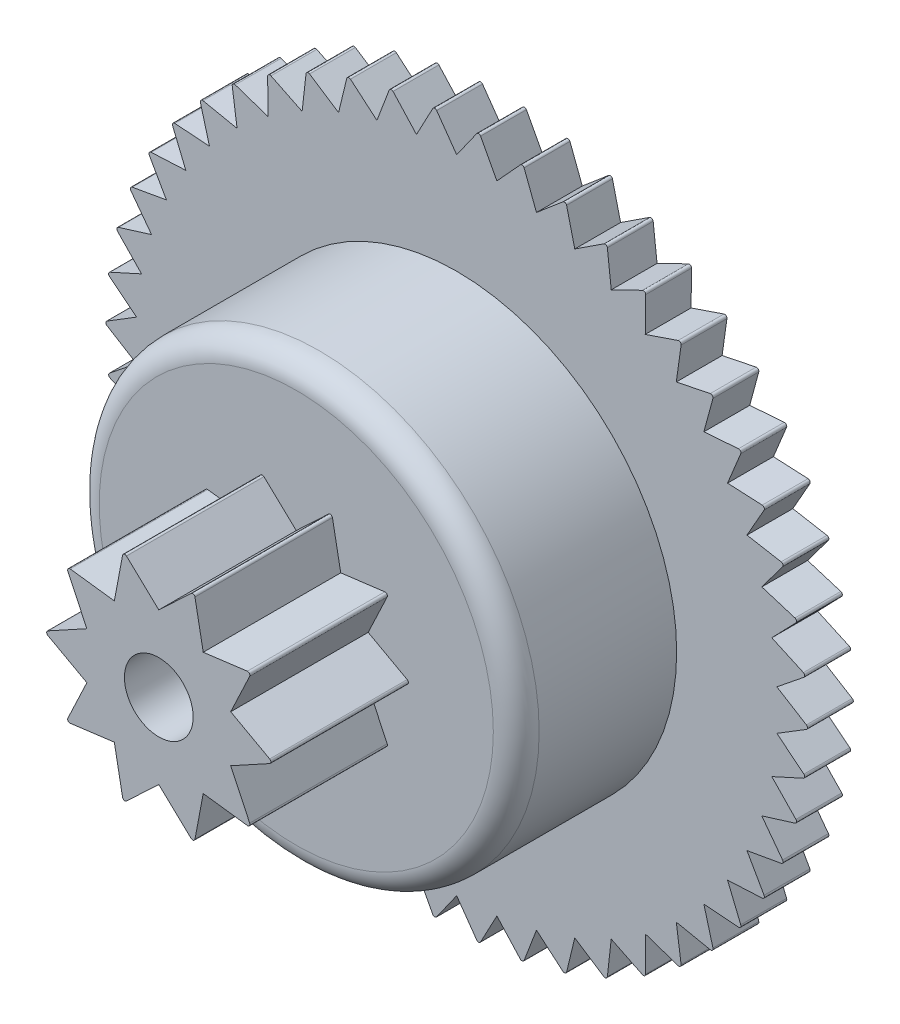
from build123d import *

# Parameters (mm, degrees)
SKETCH_1_R           = 7.7
EXTRUDE_1_DEPTH      = 1
SKETCH_2_R           = 4.8
EXTRUDE_2_DEPTH      = 3.5
SKETCH_3_R           = 2.5
EXTRUDE_3_DEPTH      = 3
SKETCH_4_OUTSIDE_W   = 22.006
SKETCH_4_OUTSIDE_H   = 22.006
CUT_EXTRUDE_7_DEPTH  = 3
SKETCH_6_OUTSIDE_W   = 21.888
SKETCH_6_OUTSIDE_H   = 21.858
CUT_EXTRUDE_8_DEPTH  = 3
SKETCH_7_R           = 0.75
CUT_EXTRUDE_9_DEPTH  = 14.160832224
SKETCH_8_R           = 3.75
CUT_EXTRUDE_10_DEPTH = 3.5
FILLET_1_R           = 0.5
FILLET_2_R           = 0.5


with BuildPart() as part:
    # 草圖1 → 伸長1 (new body)
    with BuildSketch(Plane.XY):
        Circle(SKETCH_1_R)
    extrude(amount=EXTRUDE_1_DEPTH)

    # 草圖2 → 伸長2 (add)
    with BuildSketch(Plane.XY.offset(1)):
        Circle(SKETCH_2_R)
    extrude(amount=EXTRUDE_2_DEPTH)

    # 草圖3 → 伸長3 (add)
    with BuildSketch(Plane.XY.offset(4.5)):
        Circle(SKETCH_3_R)
    extrude(amount=EXTRUDE_3_DEPTH)

    # 草圖4 outside → 伸長7 (cut)
    with BuildSketch(Plane.XY.offset(1)):
        Rectangle(SKETCH_4_OUTSIDE_W, SKETCH_4_OUTSIDE_H)
        with BuildLine():
            Line((0, 7), (0.436653531, 7.618471384))
            ThreePointArc((0.436653531, 7.618471384), (0.480638789, 7.639534792), (0.521637266, 7.61312466))
            Line((0.521637266, 7.61312466), (0.877332635, 6.944802909))
            Line((0.877332635, 6.944802909), (1.38805804, 7.503670263))
            ThreePointArc((1.38805804, 7.503670263), (1.434336407, 7.519054765), (1.471701532, 7.487714413))
            Line((1.471701532, 7.487714413), (1.74082921, 6.780082128))
            Line((1.74082921, 6.780082128), (2.317572046, 7.270531779))
            ThreePointArc((2.317572046, 7.270531779), (2.365413683, 7.279994752), (2.398556185, 7.244218437))
            Line((2.398556185, 7.244218437), (2.576871869, 6.508435401))
            Line((2.576871869, 6.508435401), (3.210536556, 6.922732666))
            ThreePointArc((3.210536556, 6.922732666), (3.259186973, 6.926124873), (3.287584175, 6.886476808))
            Line((3.287584175, 6.886476808), (3.372275719, 6.13414676))
            Line((3.372275719, 6.13414676), (4.052868986, 6.465757923))
            ThreePointArc((4.052868986, 6.465757923), (4.101560936, 6.463025868), (4.124764998, 6.420131326))
            Line((4.124764998, 6.420131326), (4.114496766, 5.663118961))
            Line((4.114496766, 5.663118961), (4.831285251, 5.906814315))
            ThreePointArc((4.831285251, 5.906814315), (4.879250834, 5.898001084), (4.896895813, 5.852536538))
            Line((4.896895813, 5.852536538), (4.791829742, 5.102780392))
            Line((4.791829742, 5.102780392), (5.533509262, 5.254716717))
            ThreePointArc((5.533509262, 5.254716717), (5.579992031, 5.239961299), (5.591799655, 5.192643753))
            Line((5.591799655, 5.192643753), (5.393592699, 4.461967928))
            Line((5.393592699, 4.461967928), (6.148466527, 4.519749097))
            ThreePointArc((6.148466527, 4.519749097), (6.192733421, 4.499284195), (6.198517477, 4.450859874))
            Line((6.198517477, 4.450859874), (5.910295479, 3.750787565))
            Line((5.910295479, 3.750787565), (6.666458801, 3.713502335))
            ThreePointArc((6.666458801, 3.713502335), (6.707811705, 3.687650691), (6.707480976, 3.638883276))
            Line((6.707480976, 3.638883276), (6.333789367, 2.980455041))
            Line((6.333789367, 2.980455041), (7.079317038, 2.848691422))
            ThreePointArc((7.079317038, 2.848691422), (7.117103791, 2.817860733), (7.110663492, 2.769519314))
            Line((7.110663492, 2.769519314), (6.657395614, 2.163118961))
            Line((6.657395614, 2.163118961), (7.380530216, 1.938954943))
            ThreePointArc((7.380530216, 1.938954943), (7.4141549, 1.903631427), (7.401706598, 1.856478379))
            Line((7.401706598, 1.856478379), (6.876010755, 1.311669202))
            Line((6.876010755, 1.311669202), (7.565348023, 0.998639987))
            ThreePointArc((7.565348023, 0.998639987), (7.594280356, 0.959380717), (7.576020369, 0.914159671))
            Line((7.576020369, 0.914159671), (6.986187099, 0.439533637))
            Line((6.986187099, 0.439533637), (7.630855773, 0.042575882))
            ThreePointArc((7.630855773, 0.042575882), (7.654639475, 0), (7.630855773, -0.042575882))
            Line((7.630855773, -0.042575882), (6.986187099, -0.439533637))
            Line((6.986187099, -0.439533637), (7.576020369, -0.914159671))
            ThreePointArc((7.576020369, -0.914159671), (7.594280356, -0.959380717), (7.565348023, -0.998639987))
            Line((7.565348023, -0.998639987), (6.876010755, -1.311669202))
            Line((6.876010755, -1.311669202), (7.401706598, -1.856478379))
            ThreePointArc((7.401706598, -1.856478379), (7.4141549, -1.903631427), (7.380530216, -1.938954943))
            Line((7.380530216, -1.938954943), (6.657395614, -2.163118961))
            Line((6.657395614, -2.163118961), (7.110663492, -2.769519314))
            ThreePointArc((7.110663492, -2.769519314), (7.117103791, -2.817860733), (7.079317038, -2.848691422))
            Line((7.079317038, -2.848691422), (6.333789367, -2.980455041))
            Line((6.333789367, -2.980455041), (6.707480976, -3.638883276))
            ThreePointArc((6.707480976, -3.638883276), (6.707811705, -3.687650691), (6.666458801, -3.713502335))
            Line((6.666458801, -3.713502335), (5.910295479, -3.750787565))
            Line((5.910295479, -3.750787565), (6.198517477, -4.450859874))
            ThreePointArc((6.198517477, -4.450859874), (6.192733421, -4.499284195), (6.148466527, -4.519749097))
            Line((6.148466527, -4.519749097), (5.393592699, -4.461967928))
            Line((5.393592699, -4.461967928), (5.591799655, -5.192643753))
            ThreePointArc((5.591799655, -5.192643753), (5.579992031, -5.239961299), (5.533509262, -5.254716717))
            Line((5.533509262, -5.254716717), (4.791829742, -5.102780392))
            Line((4.791829742, -5.102780392), (4.896895813, -5.852536538))
            ThreePointArc((4.896895813, -5.852536538), (4.879250834, -5.898001084), (4.831285251, -5.906814315))
            Line((4.831285251, -5.906814315), (4.114496766, -5.663118961))
            Line((4.114496766, -5.663118961), (4.124764998, -6.420131326))
            ThreePointArc((4.124764998, -6.420131326), (4.101560936, -6.463025868), (4.052868986, -6.465757923))
            Line((4.052868986, -6.465757923), (3.372275719, -6.13414676))
            Line((3.372275719, -6.13414676), (3.287584175, -6.886476808))
            ThreePointArc((3.287584175, -6.886476808), (3.259186973, -6.926124873), (3.210536556, -6.922732666))
            Line((3.210536556, -6.922732666), (2.576871869, -6.508435401))
            Line((2.576871869, -6.508435401), (2.398556185, -7.244218437))
            ThreePointArc((2.398556185, -7.244218437), (2.365413683, -7.279994752), (2.317572046, -7.270531779))
            Line((2.317572046, -7.270531779), (1.74082921, -6.780082128))
            Line((1.74082921, -6.780082128), (1.471701532, -7.487714413))
            ThreePointArc((1.471701532, -7.487714413), (1.434336407, -7.519054765), (1.38805804, -7.503670263))
            Line((1.38805804, -7.503670263), (0.877332635, -6.944802909))
            Line((0.877332635, -6.944802909), (0.521637266, -7.61312466))
            ThreePointArc((0.521637266, -7.61312466), (0.480638789, -7.639534792), (0.436653531, -7.618471384))
            Line((0.436653531, -7.618471384), (0, -7))
            Line((0, -7), (-0.436653531, -7.618471384))
            ThreePointArc((-0.436653531, -7.618471384), (-0.480638789, -7.639534792), (-0.521637266, -7.61312466))
            Line((-0.521637266, -7.61312466), (-0.877332635, -6.944802909))
            Line((-0.877332635, -6.944802909), (-1.38805804, -7.503670263))
            ThreePointArc((-1.38805804, -7.503670263), (-1.434336407, -7.519054765), (-1.471701532, -7.487714413))
            Line((-1.471701532, -7.487714413), (-1.74082921, -6.780082128))
            Line((-1.74082921, -6.780082128), (-2.317572046, -7.270531779))
            ThreePointArc((-2.317572046, -7.270531779), (-2.365413683, -7.279994752), (-2.398556185, -7.244218437))
            Line((-2.398556185, -7.244218437), (-2.576871869, -6.508435401))
            Line((-2.576871869, -6.508435401), (-3.210536556, -6.922732666))
            ThreePointArc((-3.210536556, -6.922732666), (-3.259186973, -6.926124873), (-3.287584175, -6.886476808))
            Line((-3.287584175, -6.886476808), (-3.372275719, -6.13414676))
            Line((-3.372275719, -6.13414676), (-4.052868986, -6.465757923))
            ThreePointArc((-4.052868986, -6.465757923), (-4.101560936, -6.463025868), (-4.124764998, -6.420131326))
            Line((-4.124764998, -6.420131326), (-4.114496766, -5.663118961))
            Line((-4.114496766, -5.663118961), (-4.831285251, -5.906814315))
            ThreePointArc((-4.831285251, -5.906814315), (-4.879250834, -5.898001084), (-4.896895813, -5.852536538))
            Line((-4.896895813, -5.852536538), (-4.791829742, -5.102780392))
            Line((-4.791829742, -5.102780392), (-5.533509262, -5.254716717))
            ThreePointArc((-5.533509262, -5.254716717), (-5.579992031, -5.239961299), (-5.591799655, -5.192643753))
            Line((-5.591799655, -5.192643753), (-5.393592699, -4.461967928))
            Line((-5.393592699, -4.461967928), (-6.148466527, -4.519749097))
            ThreePointArc((-6.148466527, -4.519749097), (-6.192733421, -4.499284195), (-6.198517477, -4.450859874))
            Line((-6.198517477, -4.450859874), (-5.910295479, -3.750787565))
            Line((-5.910295479, -3.750787565), (-6.666458801, -3.713502335))
            ThreePointArc((-6.666458801, -3.713502335), (-6.707811705, -3.687650691), (-6.707480976, -3.638883276))
            Line((-6.707480976, -3.638883276), (-6.333789367, -2.980455041))
            Line((-6.333789367, -2.980455041), (-7.079317038, -2.848691422))
            ThreePointArc((-7.079317038, -2.848691422), (-7.117103791, -2.817860733), (-7.110663492, -2.769519314))
            Line((-7.110663492, -2.769519314), (-6.657395614, -2.163118961))
            Line((-6.657395614, -2.163118961), (-7.380530216, -1.938954943))
            ThreePointArc((-7.380530216, -1.938954943), (-7.4141549, -1.903631427), (-7.401706598, -1.856478379))
            Line((-7.401706598, -1.856478379), (-6.876010755, -1.311669202))
            Line((-6.876010755, -1.311669202), (-7.565348023, -0.998639987))
            ThreePointArc((-7.565348023, -0.998639987), (-7.594280356, -0.959380717), (-7.576020369, -0.914159671))
            Line((-7.576020369, -0.914159671), (-6.986187099, -0.439533637))
            Line((-6.986187099, -0.439533637), (-7.630855773, -0.042575882))
            ThreePointArc((-7.630855773, -0.042575882), (-7.654639475, 0), (-7.630855773, 0.042575882))
            Line((-7.630855773, 0.042575882), (-6.986187099, 0.439533637))
            Line((-6.986187099, 0.439533637), (-7.576020369, 0.914159671))
            ThreePointArc((-7.576020369, 0.914159671), (-7.594280356, 0.959380717), (-7.565348023, 0.998639987))
            Line((-7.565348023, 0.998639987), (-6.876010755, 1.311669202))
            Line((-6.876010755, 1.311669202), (-7.401706598, 1.856478379))
            ThreePointArc((-7.401706598, 1.856478379), (-7.4141549, 1.903631427), (-7.380530216, 1.938954943))
            Line((-7.380530216, 1.938954943), (-6.657395614, 2.163118961))
            Line((-6.657395614, 2.163118961), (-7.110663492, 2.769519314))
            ThreePointArc((-7.110663492, 2.769519314), (-7.117103791, 2.817860733), (-7.079317038, 2.848691422))
            Line((-7.079317038, 2.848691422), (-6.333789367, 2.980455041))
            Line((-6.333789367, 2.980455041), (-6.707480976, 3.638883276))
            ThreePointArc((-6.707480976, 3.638883276), (-6.707811705, 3.687650691), (-6.666458801, 3.713502335))
            Line((-6.666458801, 3.713502335), (-5.910295479, 3.750787565))
            Line((-5.910295479, 3.750787565), (-6.198517477, 4.450859874))
            ThreePointArc((-6.198517477, 4.450859874), (-6.192733421, 4.499284195), (-6.148466527, 4.519749097))
            Line((-6.148466527, 4.519749097), (-5.393592699, 4.461967928))
            Line((-5.393592699, 4.461967928), (-5.591799655, 5.192643753))
            ThreePointArc((-5.591799655, 5.192643753), (-5.579992031, 5.239961299), (-5.533509262, 5.254716717))
            Line((-5.533509262, 5.254716717), (-4.791829742, 5.102780392))
            Line((-4.791829742, 5.102780392), (-4.896895813, 5.852536538))
            ThreePointArc((-4.896895813, 5.852536538), (-4.879250834, 5.898001084), (-4.831285251, 5.906814315))
            Line((-4.831285251, 5.906814315), (-4.114496766, 5.663118961))
            Line((-4.114496766, 5.663118961), (-4.124764998, 6.420131326))
            ThreePointArc((-4.124764998, 6.420131326), (-4.101560936, 6.463025868), (-4.052868986, 6.465757923))
            Line((-4.052868986, 6.465757923), (-3.372275719, 6.13414676))
            Line((-3.372275719, 6.13414676), (-3.287584175, 6.886476808))
            ThreePointArc((-3.287584175, 6.886476808), (-3.259186973, 6.926124873), (-3.210536556, 6.922732666))
            Line((-3.210536556, 6.922732666), (-2.576871869, 6.508435401))
            Line((-2.576871869, 6.508435401), (-2.398556185, 7.244218437))
            ThreePointArc((-2.398556185, 7.244218437), (-2.365413683, 7.279994752), (-2.317572046, 7.270531779))
            Line((-2.317572046, 7.270531779), (-1.74082921, 6.780082128))
            Line((-1.74082921, 6.780082128), (-1.471701532, 7.487714413))
            ThreePointArc((-1.471701532, 7.487714413), (-1.434336407, 7.519054765), (-1.38805804, 7.503670263))
            Line((-1.38805804, 7.503670263), (-0.877332635, 6.944802909))
            Line((-0.877332635, 6.944802909), (-0.521637266, 7.61312466))
            ThreePointArc((-0.521637266, 7.61312466), (-0.480638789, 7.639534792), (-0.436653531, 7.618471384))
            Line((-0.436653531, 7.618471384), (0, 7))
        make_face(mode=Mode.SUBTRACT)
    extrude(amount=-CUT_EXTRUDE_7_DEPTH, mode=Mode.SUBTRACT)

    # 草圖6 outside → 伸長8 (cut)
    with BuildSketch(Plane.XY.offset(7.5)):
        Rectangle(SKETCH_6_OUTSIDE_W, SKETCH_6_OUTSIDE_H)
        with BuildLine():
            Line((0, 1.65), (0.70610115, 2.315061614))
            ThreePointArc((0.70610115, 2.315061614), (0.755833785, 2.326217198), (0.789511244, 2.287960031))
            Line((0.789511244, 2.287960031), (0.969845666, 1.334878041))
            Line((0.969845666, 1.334878041), (1.932006905, 1.457888346))
            ThreePointArc((1.932006905, 1.457888346), (1.97879854, 1.437681294), (1.983557178, 1.386935482))
            Line((1.983557178, 1.386935482), (1.569243252, 0.509878041))
            Line((1.569243252, 0.509878041), (2.419951688, 0.043851282))
            ThreePointArc((2.419951688, 0.043851282), (2.445929509, 0), (2.419951688, -0.043851282))
            Line((2.419951688, -0.043851282), (1.569243252, -0.509878041))
            Line((1.569243252, -0.509878041), (1.983557178, -1.386935482))
            ThreePointArc((1.983557178, -1.386935482), (1.97879854, -1.437681294), (1.932006905, -1.457888346))
            Line((1.932006905, -1.457888346), (0.969845666, -1.334878041))
            Line((0.969845666, -1.334878041), (0.789511244, -2.287960031))
            ThreePointArc((0.789511244, -2.287960031), (0.755833785, -2.326217198), (0.70610115, -2.315061614))
            Line((0.70610115, -2.315061614), (0, -1.65))
            Line((0, -1.65), (-0.70610115, -2.315061614))
            ThreePointArc((-0.70610115, -2.315061614), (-0.755833785, -2.326217198), (-0.789511244, -2.287960031))
            Line((-0.789511244, -2.287960031), (-0.969845666, -1.334878041))
            Line((-0.969845666, -1.334878041), (-1.932006905, -1.457888346))
            ThreePointArc((-1.932006905, -1.457888346), (-1.97879854, -1.437681294), (-1.983557178, -1.386935482))
            Line((-1.983557178, -1.386935482), (-1.569243252, -0.509878041))
            Line((-1.569243252, -0.509878041), (-2.419951688, -0.043851282))
            ThreePointArc((-2.419951688, -0.043851282), (-2.445929509, 0), (-2.419951688, 0.043851282))
            Line((-2.419951688, 0.043851282), (-1.569243252, 0.509878041))
            Line((-1.569243252, 0.509878041), (-1.983557178, 1.386935482))
            ThreePointArc((-1.983557178, 1.386935482), (-1.97879854, 1.437681294), (-1.932006905, 1.457888346))
            Line((-1.932006905, 1.457888346), (-0.969845666, 1.334878041))
            Line((-0.969845666, 1.334878041), (-0.789511244, 2.287960031))
            ThreePointArc((-0.789511244, 2.287960031), (-0.755833785, 2.326217198), (-0.70610115, 2.315061614))
            Line((-0.70610115, 2.315061614), (0, 1.65))
        make_face(mode=Mode.SUBTRACT)
    extrude(amount=-CUT_EXTRUDE_8_DEPTH, mode=Mode.SUBTRACT)

    # 草圖7 → 伸長9 (cut, through all)
    with BuildSketch(Plane.XY.offset(7.5)):
        Circle(SKETCH_7_R)
    extrude(amount=-CUT_EXTRUDE_9_DEPTH, mode=Mode.SUBTRACT)

    # 草圖8 → 伸長10 (cut)
    with BuildSketch(Plane(origin=(0, 0, 0), x_dir=(-1, 0, 0), z_dir=(0, 0, -1))):
        Circle(SKETCH_8_R)
    extrude(amount=-CUT_EXTRUDE_10_DEPTH, mode=Mode.SUBTRACT)

    # 圓角1
    fillet_1_edges = [part.edges().sort_by_distance(p)[0] for p in [
        (-4.8, 0, 4.5),
    ]]
    fillet(fillet_1_edges, radius=FILLET_1_R)

    # 圓角2
    fillet_2_edges = [part.edges().sort_by_distance(p)[0] for p in [
        (3.75, 0, 3.5),
    ]]
    fillet(fillet_2_edges, radius=FILLET_2_R)


solid = part.part
